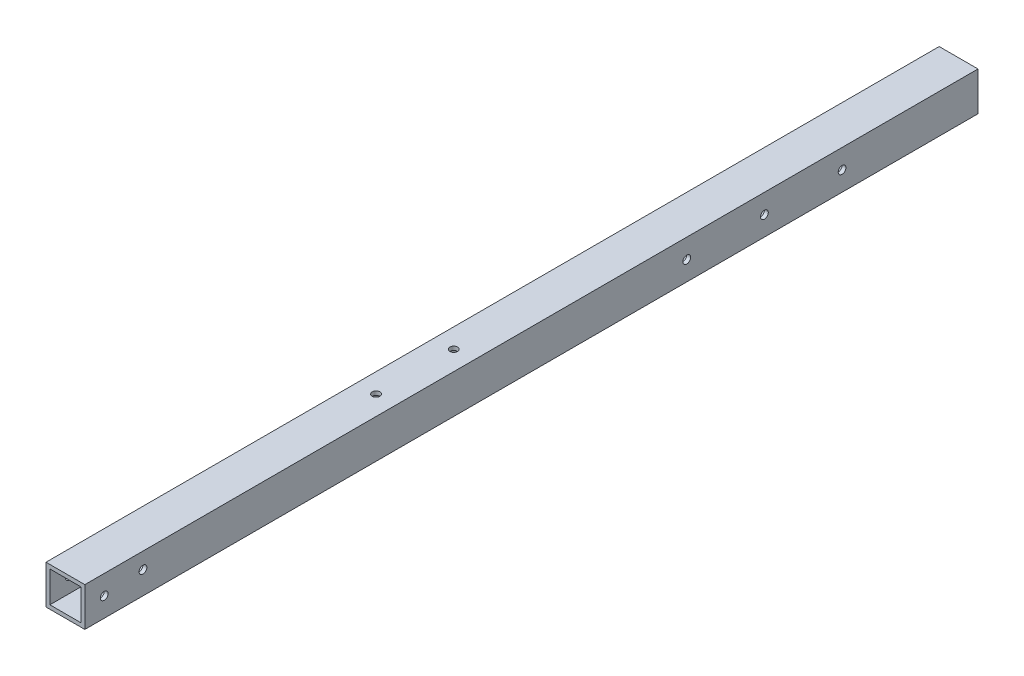
from build123d import *

# Parameters (mm, degrees)
SKETCH_1_W          = 20
SKETCH_1_H          = 20
SKETCH_1_W_2        = 16
SKETCH_1_H_2        = 16
EXTRUDE_1_DEPTH     = 460
SKETCH_2_R          = 2
CUT_EXTRUDE_1_DEPTH = 461.543157587
SKETCH_3_R          = 2
CUT_EXTRUDE_2_DEPTH = 461.543157587


with BuildPart() as part:
    # 草图1 → 凸台-拉伸1 (new body)
    with BuildSketch(Plane.XY):
        Rectangle(SKETCH_1_W, SKETCH_1_H)
        Rectangle(SKETCH_1_W_2, SKETCH_1_H_2, mode=Mode.SUBTRACT)
    extrude(amount=EXTRUDE_1_DEPTH)

    # 草图2 → 切除-拉伸1 (cut, through all)
    with BuildSketch(Plane(origin=(10, 0, 0), x_dir=(0, 0, -1), z_dir=(1, 0, 0))):
        with Locations((-450, 0)):
            Circle(SKETCH_2_R)
        with Locations((-70, 0)):
            Circle(SKETCH_2_R)
        with Locations((-110, 0)):
            Circle(SKETCH_2_R)
        with Locations((-150, 0)):
            Circle(SKETCH_2_R)
        with Locations((-37.153023279, -18.374821325)):
            Circle(SKETCH_2_R)
        with Locations((-17.227343837, -16.652236413)):
            Circle(SKETCH_2_R)
        with Locations((-430.074320558, 1.722584912)):
            Circle(SKETCH_2_R)
    extrude(amount=-CUT_EXTRUDE_1_DEPTH, mode=Mode.SUBTRACT)

    # 草图3 → 切除-拉伸2 (cut, through all)
    with BuildSketch(Plane(origin=(0, 10, 0), x_dir=(1, 0, 0), z_dir=(0, 1, 0))):
        with Locations(Location((0, -260, 0), (0, 0, 270))):
            Circle(SKETCH_3_R)
        with Locations(Location((0, -300, 0), (0, 0, 270))):
            Circle(SKETCH_3_R)
    extrude(amount=-CUT_EXTRUDE_2_DEPTH, mode=Mode.SUBTRACT)


solid = part.part
